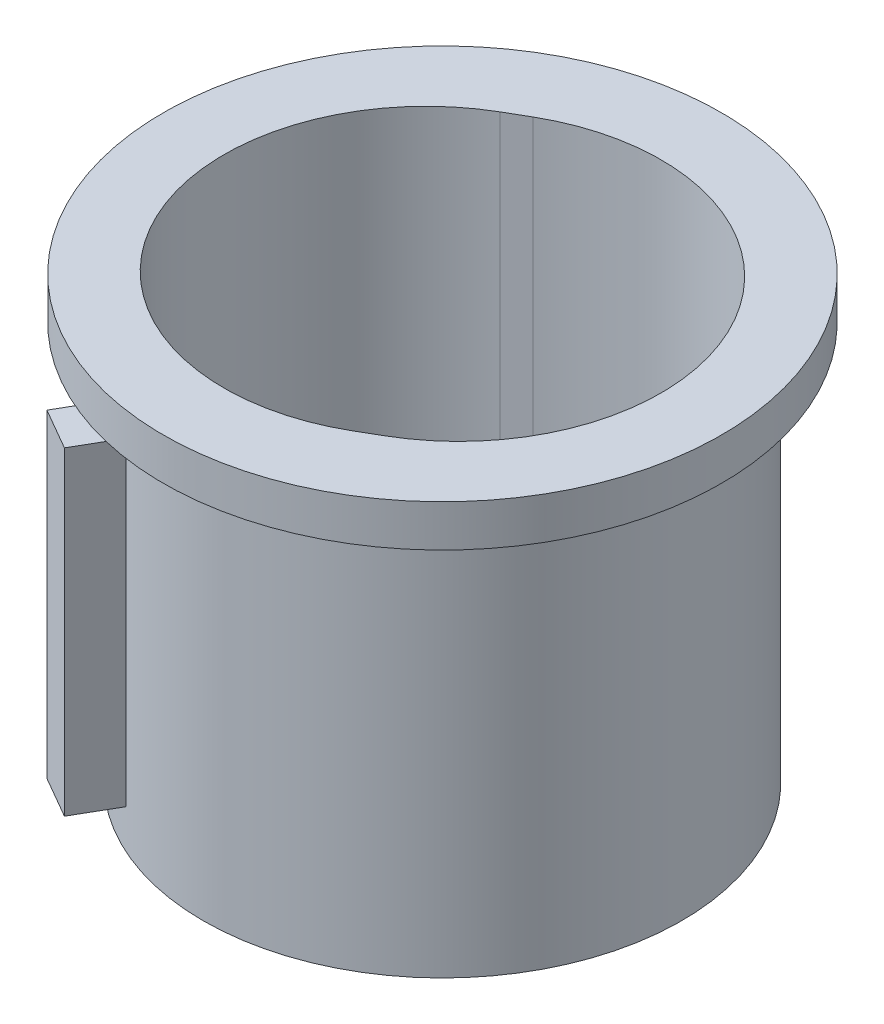
from build123d import *

# Parameters (mm, degrees)
GUIDE_BUSH_BARREL_SKETCH_R      = 6
GUIDE_BUSH_BARREL_DEPTH         = 10
GUIDE_BUSH_FLANGE_SKETCH_R      = 7
GUIDE_BUSH_FLANGE_DEPTH         = 1.05
DIRECTIONAL_RUNNING_SLOT_DEPTH  = 11.25
ANTIROTATION_GUIDE_KEY_SKETCH_W = 1.3
ANTIROTATION_GUIDE_KEY_SKETCH_H = 1.2
ANTIROTATION_GUIDE_KEY_DEPTH    = 8
MOVE2_ANGLE                     = 120


with BuildPart() as part:
    # Guide bush barrel sketch → Guide bush barrel (new body)
    with BuildSketch(Plane(origin=(0, -105.98, 0), x_dir=(1, 0, 0), z_dir=(0, 1, 0))):
        with Locations(Location((-20.291651246, 0, 0), (0, 0, 270))):
            Circle(GUIDE_BUSH_BARREL_SKETCH_R)
    extrude(amount=GUIDE_BUSH_BARREL_DEPTH)

    # Guide bush flange sketch → Guide bush flange (add)
    with BuildSketch(Plane(origin=(0, -95.98, 0), x_dir=(1, 0, 0), z_dir=(0, 1, 0))):
        with Locations(Location((-20.291651246, 0, 0), (0, 0, 270))):
            Circle(GUIDE_BUSH_FLANGE_SKETCH_R)
    extrude(amount=GUIDE_BUSH_FLANGE_DEPTH)

    # Directional running slot sketch → Directional running slot (cut)
    with BuildSketch(Plane(origin=(0, -106.08, 0), x_dir=(1, 0, 0), z_dir=(0, 1, 0))):
        with BuildLine():
            Line((-23.086458867, -4.240748797), (-22.566843625, -4.540748797))
            ThreePointArc((-22.566843625, -4.540748797), (-15.641094828, -2.685), (-17.496843625, 4.240748797))
            Line((-17.496843625, 4.240748797), (-18.016458867, 4.540748797))
            ThreePointArc((-18.016458867, 4.540748797), (-24.942207664, 2.685), (-23.086458867, -4.240748797))
        make_face()
    extrude(amount=DIRECTIONAL_RUNNING_SLOT_DEPTH, mode=Mode.SUBTRACT)

    # Antirotation guide key sketch → Antirotation guide key (add)
    with BuildSketch(Plane(origin=(0, -105, 0), x_dir=(1, 0, 0), z_dir=(0, 1, 0))):
        with Locations((-13.841651246, 0)):
            Rectangle(ANTIROTATION_GUIDE_KEY_SKETCH_W, ANTIROTATION_GUIDE_KEY_SKETCH_H)
    extrude(amount=ANTIROTATION_GUIDE_KEY_DEPTH)


with BuildPart() as part_1:
    # Move1: moved
    add(part.part.moved(Location((56.291651246, 0, 0))))


with BuildPart() as part_2:
    # Move2: moved
    add(part_1.part.rotate(Axis((0, 0, 0), (0, -1, 0)), MOVE2_ANGLE))


with BuildPart() as part_3:
    # Move3: moved
    add(part_2.part.moved(Location((-56.291651246, 0, 0))))


solid = part_3.part
